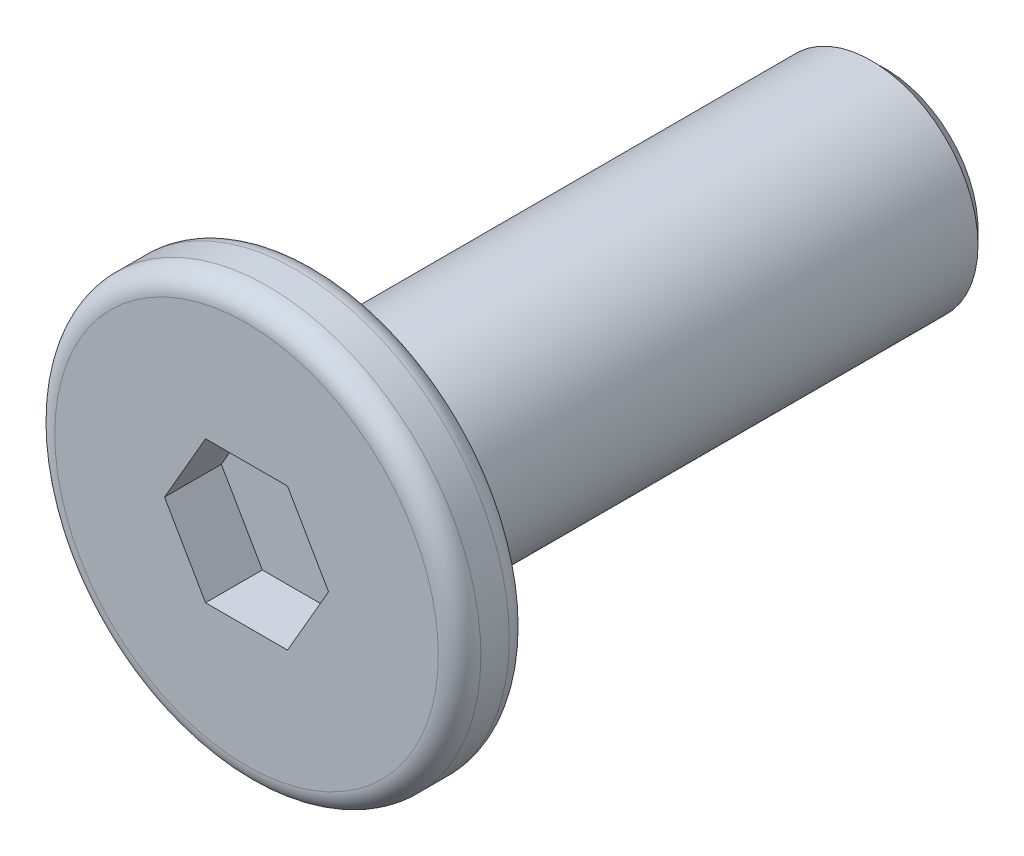
from build123d import *

# Parameters (mm, degrees)
SKETCH_1_R          = 3
EXTRUDE_1_DEPTH     = 0.5
SKETCH_2_R          = 1.5
EXTRUDE_2_DEPTH     = 8
CHAMFER_1_SIZE      = 0.2
CUT_EXTRUDE_1_DEPTH = 0.8
FILLET_2_R          = 0.3


with BuildPart() as part:
    # 草图1 → 凸台-拉伸1 (new, symmetric)
    with BuildSketch(Plane.XY):
        Circle(SKETCH_1_R)
    extrude(amount=EXTRUDE_1_DEPTH, both=True)

    # 草图2 → 凸台-拉伸2 (add)
    with BuildSketch(Plane(origin=(0, 0, -0.5), x_dir=(-1, 0, 0), z_dir=(0, 0, -1))):
        Circle(SKETCH_2_R)
    extrude(amount=EXTRUDE_2_DEPTH)

    # 倒角1
    chamfer_1_edges = [part.edges().sort_by_distance(p)[0] for p in [
        (1.5, 0, -8.5),
    ]]
    chamfer(chamfer_1_edges, length=CHAMFER_1_SIZE)

    # 草图3 → 切除-拉伸1 (cut)
    with BuildSketch(Plane.XY.offset(0.5)):
        Polygon((1.154700538, 0), (0.577350269, 1), (-0.577350269, 1), (-1.154700538, 0), (-0.577350269, -1), (0.577350269, -1), align=None)
    extrude(amount=-CUT_EXTRUDE_1_DEPTH, mode=Mode.SUBTRACT)

    # 圆角2
    fillet_2_edges = [part.edges().sort_by_distance(p)[0] for p in [
        (-3, 0, -0.5),
        (-3, 0, 0.5),
    ]]
    fillet(fillet_2_edges, radius=FILLET_2_R)


solid = part.part
